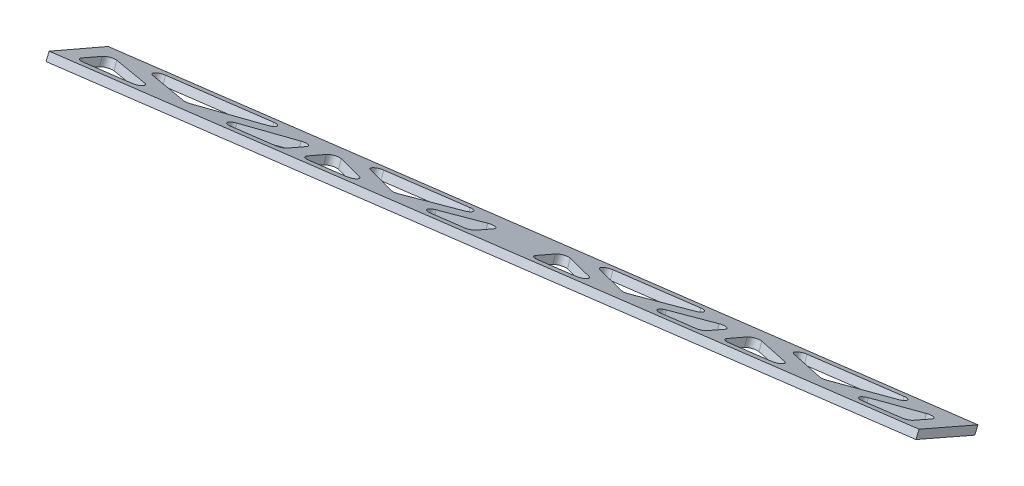
from build123d import *

# Parameters (mm, degrees)
CUT_EXTRUDE1_DEPTH      = 363.305340744
CUT_EXTRUDE1_DEPTH_BACK = 363.305340744
FILLET1_R               = 2.54


with BuildPart() as part:
    # Sketch1<5> → Loft4 section 0
    with BuildSketch(Plane(origin=(0, 0, 0), x_dir=(0, 0, -1), z_dir=(1, 0, 0))):
        with BuildLine():
            Line((168.594795862, -54.647515272), (191.882473097, -64.788722746))
            Line((191.882473097, -64.788722746), (193.150124031, -61.877763092))
            Line((193.150124031, -61.877763092), (169.862446797, -51.736555617))
            Line((169.862446797, -51.736555617), (168.594795862, -54.647515272))
        make_face()
    # Sketch2<5> → Loft4 section 1
    with BuildSketch(Plane(origin=(-301.244, 0, 0), x_dir=(0, 0, -1), z_dir=(1, 0, 0))):
        with BuildLine():
            Line((149.157729545, -64.472266247), (125.828368959, -54.427320521))
            Line((125.828368959, -54.427320521), (127.083987175, -51.511150448))
            Line((127.083987175, -51.511150448), (150.413347761, -61.556096174))
            Line((150.413347761, -61.556096174), (149.157729545, -64.472266247))
        make_face()
    loft()

    # Sketch3 → Cut-Extrude1 (cut, two sides: drawn at the far end of the back side and taken through both)
    with BuildSketch(Plane(origin=(-1.131202962, 18.632262913, -8.113889677), x_dir=(0.9984544003855876, 0.05095514931282001, -0.0221897072798398), z_dir=(-0.055577066769097815, 0.9154206224136013, -0.39864304046256493)).offset(-CUT_EXTRUDE1_DEPTH_BACK)):
        Polygon((-294.275324235, 141.107562556), (-294.241475185, 156.716546542), (-264.807096902, 144.944117928), align=None)
        Polygon((-251.175980474, 146.718793152), (-222.438597944, 150.460197685), (-222.438597944, 165.683563976), align=None)
        Polygon((-180.270209199, 155.950224503), (-156.9286881, 158.989125932), (-156.9286881, 174.008873185), align=None)
        Polygon((-287.785158615, 160.973363376), (-229.620947576, 168.551806469), (-258.719765457, 149.348512231), align=None)
        Polygon((-100.429933768, 166.344865284), (-76.767572133, 169.425537888), (-76.767572133, 184.46838632), align=None)
        Polygon((-5.217045944, 193.88806113), (-5.217045944, 178.740911781), (-31.13923359, 175.366025768), align=None)
        Polygon((-70.417572133, 170.252263104), (-70.417572133, 185.808231519), (-43.786545166, 173.719434997), align=None)
        Polygon((-136.674027526, 161.626139891), (-136.674027526, 177.104861071), (-112.318302323, 164.797083542), align=None)
        Polygon((-216.088597944, 151.286922901), (-216.088597944, 166.746461783), (-192.056073971, 154.41578803), align=None)
        Polygon((-210.542037623, 171.037672447), (-163.168100998, 177.210208382), (-186.85506931, 158.884297346), align=None)
        Polygon((-131.077414228, 181.391429775), (-83.059437534, 187.647880216), (-107.068425881, 169.258870189), align=None)
        Polygon((-64.449367674, 190.07265918), (-11.896275571, 196.920007588), (-38.172821623, 178.144774502), align=None)
    extrude(amount=CUT_EXTRUDE1_DEPTH + CUT_EXTRUDE1_DEPTH_BACK, mode=Mode.SUBTRACT)

    # Fillet1
    fillet1_edges = [part.edges().sort_by_distance(p)[0] for p in [
        (-294.858621005, -54.234250767, -130.289133999),
        (-294.828324881, -60.406911851, -144.625899025),
        (-265.436436435, -54.256295533, -134.464086482),
        (-288.38276898, -61.764629566, -148.677580505),
        (-259.359328842, -55.691185172, -138.643125069),
        (-230.308597659, -61.824309068, -156.917441888),
        (-251.826618039, -54.266492216, -136.395294286),
        (-223.136720722, -60.323506015, -154.442596346),
        (-223.134136502, -54.287987889, -140.466704332),
        (-216.794058133, -54.2927375, -141.366349818),
        (-192.799084094, -54.310712411, -144.771192912),
        (-216.796607875, -60.423117804, -155.558526468),
        (-211.259222331, -61.843885423, -159.620264815),
        (-163.958621685, -61.892495402, -166.331515891),
        (-187.606746938, -55.819434449, -148.988009919),
        (-181.031634327, -54.319527137, -146.440972772),
        (-157.728385849, -60.30408466, -163.531515253),
        (-157.726583592, -54.336983629, -149.747917712),
        (-113.185900263, -54.370343619, -156.068162158),
        (-137.503570316, -54.352130694, -152.617527436),
        (-137.505189503, -60.505497081, -166.820616454),
        (-131.917612017, -61.925424069, -170.877657864),
        (-107.944536886, -55.877679264, -160.278250452),
        (-83.973968163, -61.974696983, -177.680146268),
        (-101.316106983, -54.379233187, -157.752465187),
        (-77.690717235, -54.396925993, -161.104867272),
        (-77.691606321, -60.388291406, -174.90309486),
        (-71.350638973, -54.401673827, -162.004513532),
        (-44.761222463, -54.421584751, -165.777506622),
        (-71.351483356, -60.598643913, -176.272868209),
        (-65.392707064, -61.993793761, -180.316550092),
        (-12.920968135, -62.047722292, -187.761506812),
        (-39.156380313, -55.899024574, -169.960860704),
        (-32.133672092, -54.431040148, -167.569334807),
        (-6.252059515, -60.496885457, -185.129896914),
        (-6.251987472, -54.450419165, -171.241902803),
    ]]
    fillet(fillet1_edges, radius=FILLET1_R)


solid = part.part
